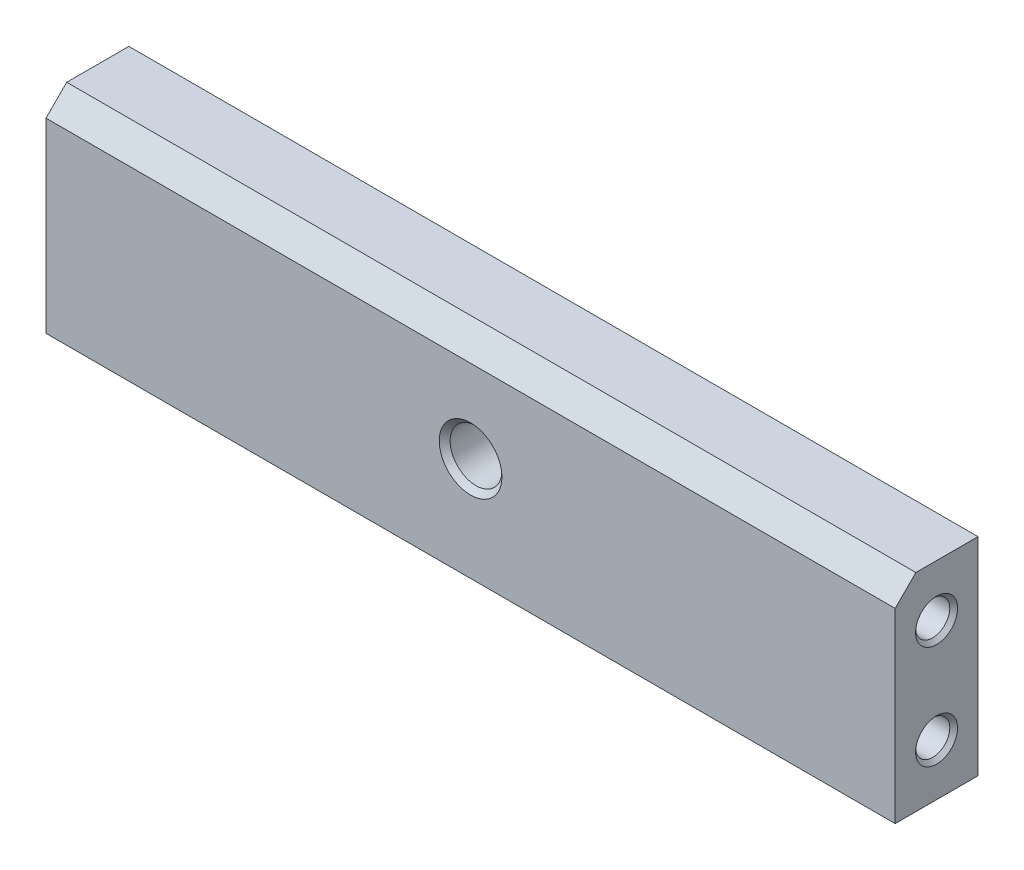
from build123d import *

# Parameters (mm, degrees)
SKETCH_1_W                   = 82
SKETCH_1_H                   = 20
EXTRUDE_1_DEPTH              = 8
HOLE_WIZARD_M6_1_D           = 5
HOLE_WIZARD_M6_1_CSINK_D     = 6.05
HOLE_WIZARD_M6_1_CSINK_ANGLE = 90
HOLE_WIZARD_M4_1_AT_2_COUNT  = 2
HOLE_WIZARD_M4_1_AT_2_PITCH  = 10
CHAMFER_1_SIZE               = 2


with BuildPart() as part:
    # 스케치1 → 보스-돌출1 (new body)
    with BuildSketch(Plane.XY):
        with Locations((41, 10)):
            Rectangle(SKETCH_1_W, SKETCH_1_H)
    extrude(amount=EXTRUDE_1_DEPTH)

    # M6 나사 구멍1 (through all)
    with Locations(Plane.XY.offset(8)):
        with Locations((41, 10)):
            CounterSinkHole(HOLE_WIZARD_M6_1_D / 2, HOLE_WIZARD_M6_1_CSINK_D / 2, counter_sink_angle=HOLE_WIZARD_M6_1_CSINK_ANGLE)

    # 스케치5 → M4 나사 구멍1 (revolve, cut)
    with BuildSketch(Plane(origin=(0, 15, 4), x_dir=(0, 0, 1), z_dir=(0, 1, 0))):
        Polygon((0, 0), (0, 12.491420021), (1.65, 11.5), (1.65, 0.375), (2.025, 0), align=None)
    hole_wizard_m4_1 = revolve(axis=Axis((-6.35, 15, 4), (1, 0, 0)), mode=Mode.SUBTRACT)

    # M4 나사 구멍1 at 2: M4 나사 구멍1 ×2
    with Locations(*[(0, -i * HOLE_WIZARD_M4_1_AT_2_PITCH, 0) for i in range(1, HOLE_WIZARD_M4_1_AT_2_COUNT)]):
        add(hole_wizard_m4_1, mode=Mode.SUBTRACT)

    # 대칭 복사1: M4 나사 구멍1 across plane
    add(hole_wizard_m4_1.mirror(Plane.ZY.offset(-41)), mode=Mode.SUBTRACT)

    # 대칭 복사1 copy 1 sketch → 대칭 복사1 copy 1 (revolve, cut)
    with BuildSketch(Plane(origin=(82, 5, 4), x_dir=(0, 0, 1), z_dir=(0, 1, 0))):
        Polygon((0, 0), (0, -12.491420021), (1.65, -11.5), (1.65, -0.375), (2.025, 0), align=None)
    revolve(axis=Axis((88.35, 5, 4), (1, 0, 0)), mode=Mode.SUBTRACT)

    # 모따기1
    chamfer_1_edges = [part.edges().sort_by_distance(p)[0] for p in [
        (41, 20, 8),
    ]]
    chamfer(chamfer_1_edges, length=CHAMFER_1_SIZE)


solid = part.part
